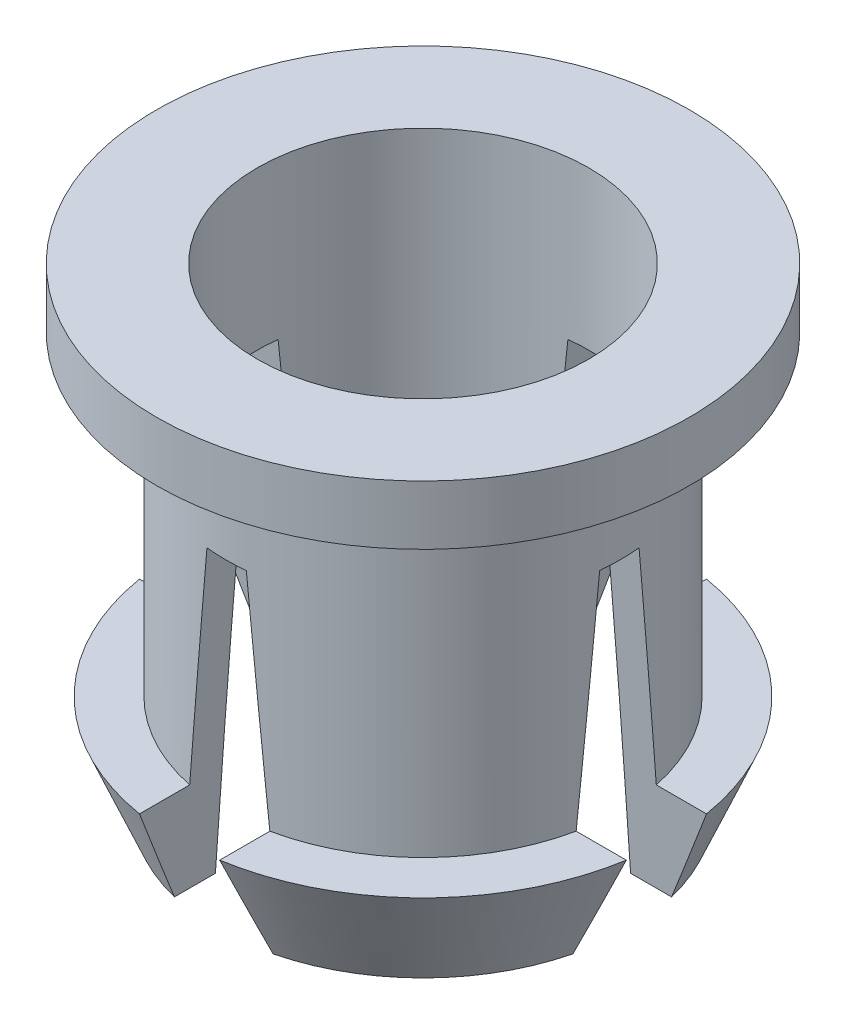
from build123d import *

# Parameters (mm, degrees)
CUT_EXTRUDE1_DEPTH = 6.637486142
CIRPATTERN1_COUNT  = 4


with BuildPart() as part:
    # Sketch1 → Revolve1 (revolve)
    with BuildSketch(Plane.XY, mode=Mode.PRIVATE) as revolve1_sk:
        Polygon((2.1, 3), (2.1, -3), (2.6, -3), (3.125, -1.75), (2.5, -1.75), (2.5, 2.25), (3.375, 2.25), (3.375, 3), align=None)
    revolve(revolve1_sk.sketch.rotate(Axis((0, 3, 0), (0, -1, 0)), 90), axis=Axis((0, 3, 0), (0, -1, 0)))

    # Sketch2 → Cut-Extrude1 (cut, symmetric)
    with BuildSketch(Plane.XY):
        Polygon((-0.249514725, 1), (0.249514725, 1), (0.625, -3), (-0.625, -3), align=None)
    cut_extrude1 = extrude(amount=CUT_EXTRUDE1_DEPTH, both=True, mode=Mode.SUBTRACT)

    # CirPattern1: Cut-Extrude1 ×4 about axis
    cirpattern1_axis = Axis((0, 3, 0), (0, 1, 0))
    for i in range(1, CIRPATTERN1_COUNT):
        add(cut_extrude1.rotate(cirpattern1_axis, i * 360 / CIRPATTERN1_COUNT), mode=Mode.SUBTRACT)


solid = part.part
